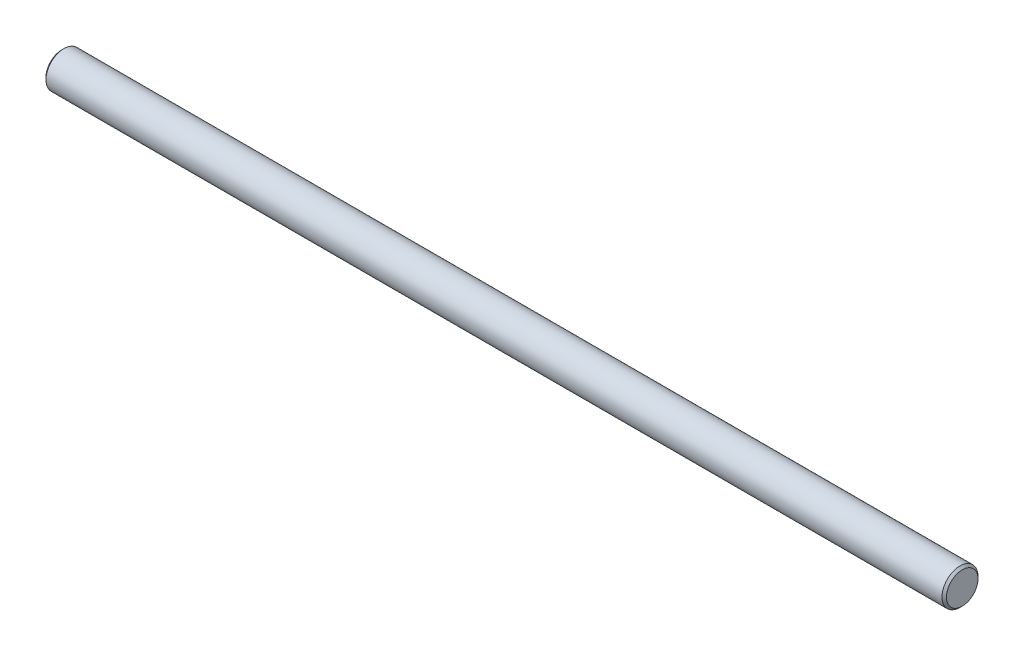
from build123d import *

# Parameters (mm, degrees)
SKETCH_1_R      = 4
EXTRUDE_1_DEPTH = 200
CHAMFER_1_SIZE  = 0.5


with BuildPart() as part:
    # 草图1 → 凸台-拉伸1 (new body)
    with BuildSketch(Plane(origin=(0, 0, 0), x_dir=(0, 0, -1), z_dir=(1, 0, 0))):
        Circle(SKETCH_1_R)
    extrude(amount=EXTRUDE_1_DEPTH)

    # 倒角1
    chamfer_1_edges = [part.edges().sort_by_distance(p)[0] for p in [
        (0, 0, 4),
        (200, 0, 4),
    ]]
    chamfer(chamfer_1_edges, length=CHAMFER_1_SIZE)


solid = part.part
